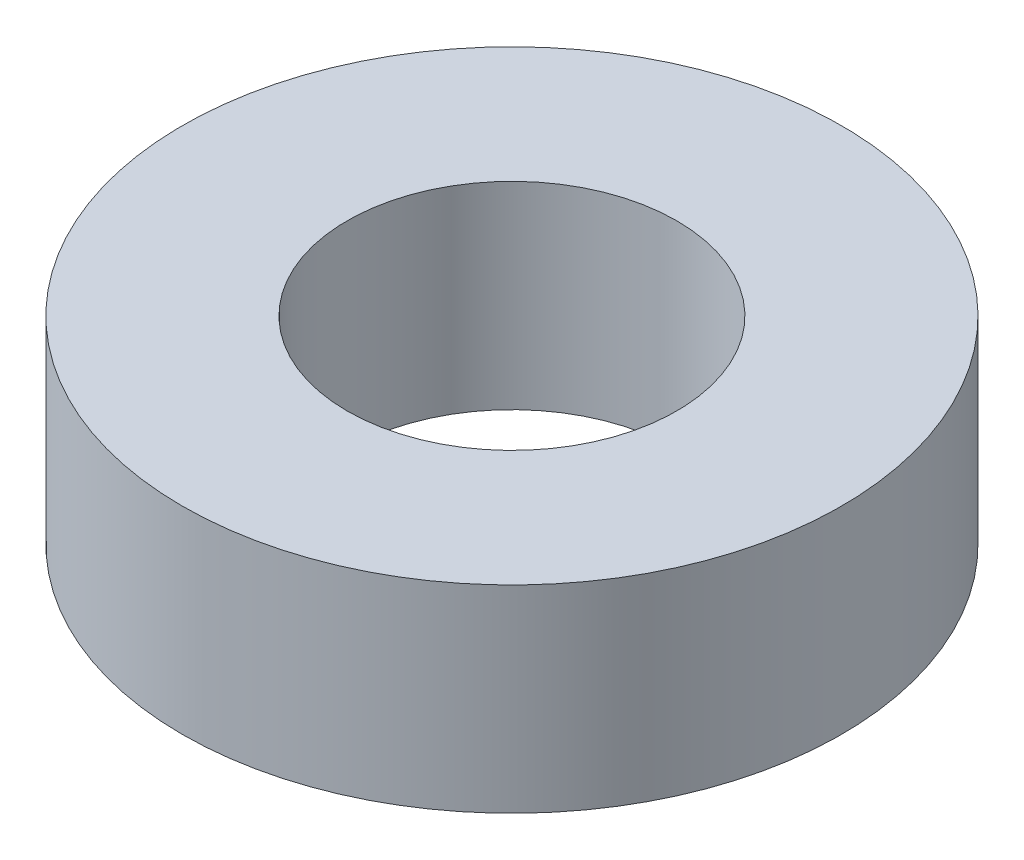
from build123d import *

# Parameters (mm, degrees)
SKETCH1_R           = 5
SKETCH1_R_2         = 2.5
BOSS_EXTRUDE1_DEPTH = 3


with BuildPart() as part:
    # Sketch1 → Boss-Extrude1 (new body)
    with BuildSketch(Plane(origin=(0, 0, 0), x_dir=(1, 0, 0), z_dir=(0, 1, 0))):
        with Locations(Location((0, 0, 0), (0, 0, 270))):
            Circle(SKETCH1_R)
        with Locations(Location((0, 0, 0), (0, 0, 270))):
            Circle(SKETCH1_R_2, mode=Mode.SUBTRACT)
    extrude(amount=BOSS_EXTRUDE1_DEPTH)


solid = part.part
